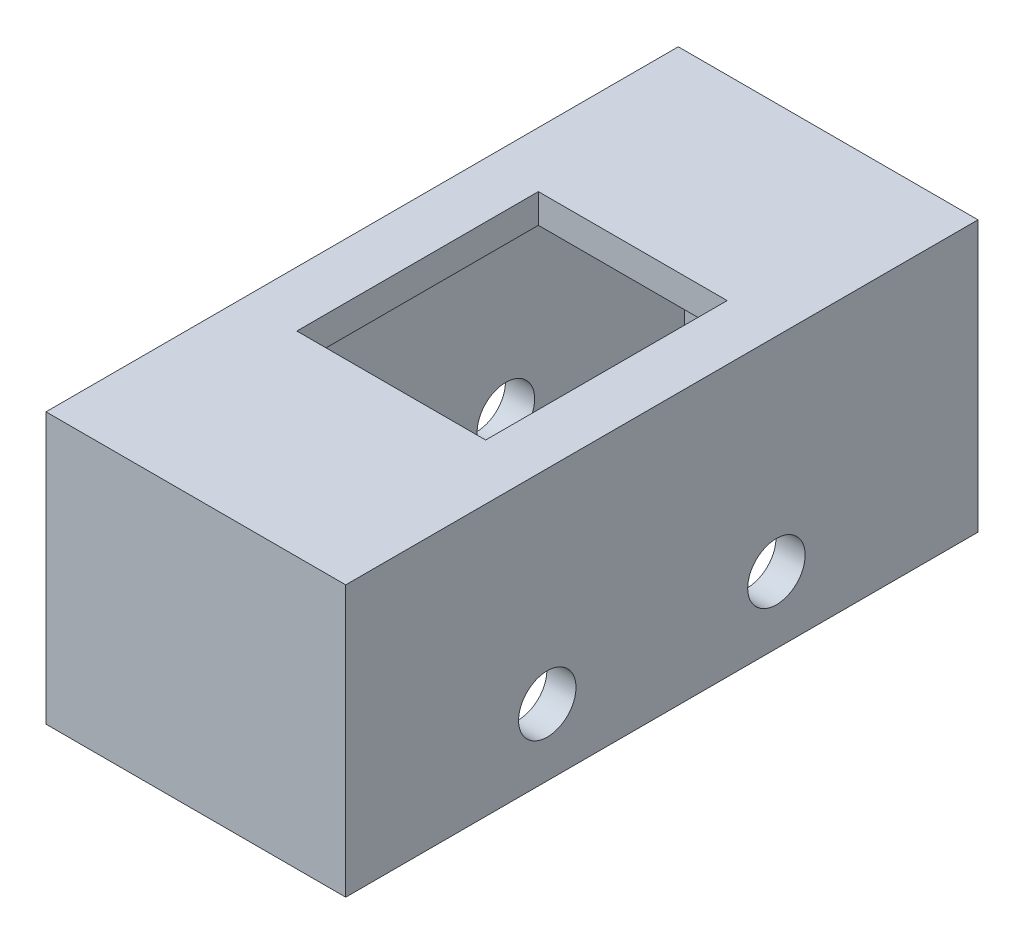
from build123d import *

# Parameters (mm, degrees)
SKETCH1_W                      = 26.08
SKETCH1_H                      = 55.016744186
SKETCH1_W_2                    = 21
SKETCH1_H_2                    = 51
BOSS_EXTRUDE1_DEPTH            = 21
SKETCH3_W                      = 26.08
SKETCH3_H                      = 2.54
BOSS_EXTRUDE2_DEPTH            = 55.016744
CUT_EXTRUDE1_REACH             = 40.482
SKETCH4_W                      = 16.428
SKETCH4_H                      = 21.016744186
CUT_EXTRUDE2_REACH             = 40.482
SKETCH5_R                      = 2.5
CUT_EXTRUDE2_DIRECTION_2_REACH = 40.482


with BuildPart() as part:
    # Sketch1 → Boss-Extrude1 (new body)
    with BuildSketch(Plane(origin=(0, 0, 0), x_dir=(1, 0, 0), z_dir=(0, 1, 0))):
        Rectangle(SKETCH1_W, SKETCH1_H)
        Rectangle(SKETCH1_W_2, SKETCH1_H_2, mode=Mode.SUBTRACT)
    extrude(amount=BOSS_EXTRUDE1_DEPTH)

    # Sketch3 → Boss-Extrude2 (add, through all)
    with BuildSketch(Plane.XY.offset(27.508372093)):
        with Locations((0, 22.27)):
            Rectangle(SKETCH3_W, SKETCH3_H)
    extrude(amount=-BOSS_EXTRUDE2_DEPTH)

    # Sketch4 → Cut-Extrude1 (cut, up to next)
    with BuildSketch(Plane(origin=(0, 23.54, 0), x_dir=(1, 0, 0), z_dir=(0, 1, 0)), mode=Mode.PRIVATE) as cut_extrude1_sk1:
        Rectangle(SKETCH4_W, SKETCH4_H)
    cut_extrude1_tool1 = extrude(cut_extrude1_sk1.sketch, amount=-CUT_EXTRUDE1_REACH, mode=Mode.PRIVATE) & part.part
    add(cut_extrude1_tool1.solids().sort_by_distance((0, 23.54, 0))[0], mode=Mode.SUBTRACT)

    # Sketch5 → Cut-Extrude2 (cut, up to next)
    with BuildSketch(Plane(origin=(0, 0, 0), x_dir=(0, 0, -1), z_dir=(1, 0, 0)), mode=Mode.PRIVATE) as cut_extrude2_sk1:
        with Locations((-9.968372093, 5.8)):
            Circle(SKETCH5_R)
    cut_extrude2_tool1 = extrude(cut_extrude2_sk1.sketch, amount=-CUT_EXTRUDE2_REACH, mode=Mode.PRIVATE) & part.part
    # Sketch5 → Cut-Extrude2 (cut, up to next)
    with BuildSketch(Plane(origin=(0, 0, 0), x_dir=(0, 0, -1), z_dir=(1, 0, 0)), mode=Mode.PRIVATE) as cut_extrude2_sk2:
        with Locations((9.968372093, 5.8)):
            Circle(SKETCH5_R)
    cut_extrude2_tool2 = extrude(cut_extrude2_sk2.sketch, amount=-CUT_EXTRUDE2_REACH, mode=Mode.PRIVATE) & part.part
    add(cut_extrude2_tool1.solids().sort_by_distance((0, 5.8, 9.968372))[0], mode=Mode.SUBTRACT)
    add(cut_extrude2_tool2.solids().sort_by_distance((0, 5.8, -9.968372))[0], mode=Mode.SUBTRACT)

    # Sketch5 → Cut-Extrude2 direction 2 (cut, up to next)
    with BuildSketch(Plane(origin=(0, 0, 0), x_dir=(0, 0, -1), z_dir=(1, 0, 0)), mode=Mode.PRIVATE) as cut_extrude2_direction_2_sk1:
        with Locations((-9.968372093, 5.8)):
            Circle(SKETCH5_R)
    cut_extrude2_direction_2_tool1 = extrude(cut_extrude2_direction_2_sk1.sketch, amount=CUT_EXTRUDE2_DIRECTION_2_REACH, mode=Mode.PRIVATE) & part.part
    # Sketch5 → Cut-Extrude2 direction 2 (cut, up to next)
    with BuildSketch(Plane(origin=(0, 0, 0), x_dir=(0, 0, -1), z_dir=(1, 0, 0)), mode=Mode.PRIVATE) as cut_extrude2_direction_2_sk2:
        with Locations((9.968372093, 5.8)):
            Circle(SKETCH5_R)
    cut_extrude2_direction_2_tool2 = extrude(cut_extrude2_direction_2_sk2.sketch, amount=CUT_EXTRUDE2_DIRECTION_2_REACH, mode=Mode.PRIVATE) & part.part
    add(cut_extrude2_direction_2_tool1.solids().sort_by_distance((0, 5.8, 9.968372))[0], mode=Mode.SUBTRACT)
    add(cut_extrude2_direction_2_tool2.solids().sort_by_distance((0, 5.8, -9.968372))[0], mode=Mode.SUBTRACT)


solid = part.part
